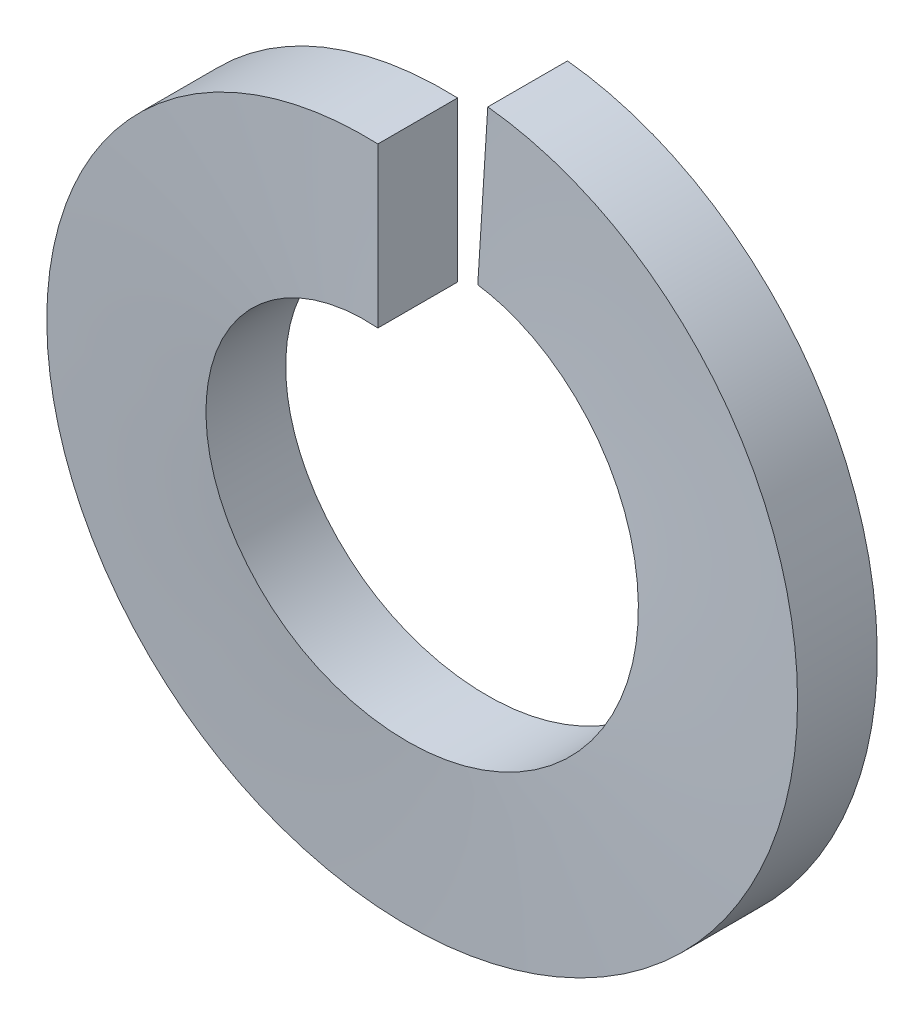
from build123d import *

# Parameters (mm, degrees)
PROFILE_SWEEP_PITCH       = 0.777777778
PROFILE_SWEEP_HEIGHT      = 0.77
PROFILE_SWEEP_RADIUS      = 3.1
PROFILE_SWEEP_START_ANGLE = 90
PROFILE_SKETCH_W          = 0.7
PROFILE_SKETCH_H          = 1.4


with BuildPart() as part:
    # Profile Sweep: sweep along a helix
    with BuildLine() as profile_sweep_path:
        add(Helix(PROFILE_SWEEP_PITCH, PROFILE_SWEEP_HEIGHT, PROFILE_SWEEP_RADIUS, center=(0, 0, 0), direction=(0, 0, -1), lefthand=True, mode=Mode.PRIVATE).rotate(Axis((0, 0, 0), (0, 0, -1)), PROFILE_SWEEP_START_ANGLE))
    # Profile Sketch → Profile Sweep (sweep)
    with BuildSketch(Plane(origin=(0, 0, 0), x_dir=(0, 0, -1), z_dir=(1, 0, 0))):
        with Locations((-0.35, 2.4)):
            Rectangle(PROFILE_SKETCH_W, PROFILE_SKETCH_H)
    sweep(path=profile_sweep_path.line, is_frenet=True)


solid = part.part
